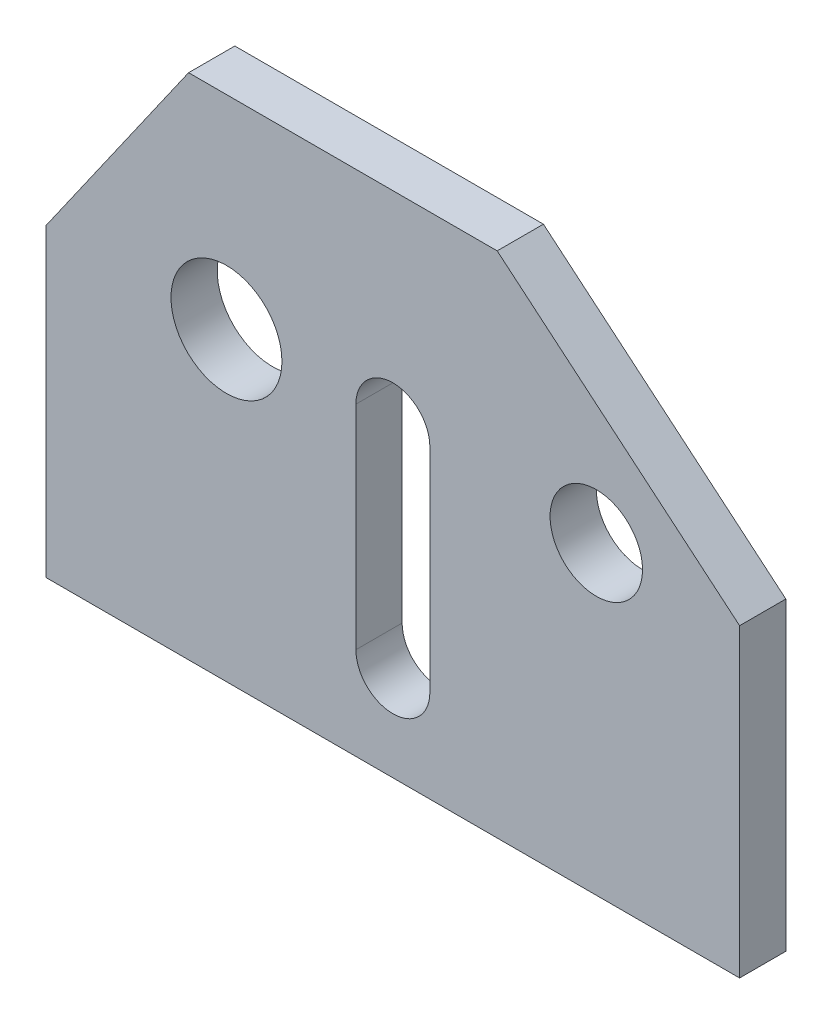
from build123d import *

# Parameters (mm, degrees)
SZKIC1_R                    = 6
SZKIC1_R_2                  = 5
DODANIE_WYCI_GNI_CIE1_DEPTH = 5


with BuildPart() as part:
    # Szkic1 → Dodanie-wyciągnięcie1 (new body)
    with BuildSketch(Plane.XY):
        Polygon((0, 0), (75, 0), (75, 33), (48.781420963, 55), (15.404565841, 55), (0, 33), align=None)
        with Locations((19.5, 33)):
            Circle(SZKIC1_R, mode=Mode.SUBTRACT)
        with Locations((59.5, 33)):
            Circle(SZKIC1_R_2, mode=Mode.SUBTRACT)
        with BuildLine():
            Line((33.5, 33), (33.5, 10))
            ThreePointArc((33.5, 10), (37.5, 6), (41.5, 10))
            Line((41.5, 10), (41.5, 33))
            ThreePointArc((41.5, 33), (37.5, 37), (33.5, 33))
        make_face(mode=Mode.SUBTRACT)
    extrude(amount=DODANIE_WYCI_GNI_CIE1_DEPTH)


solid = part.part
